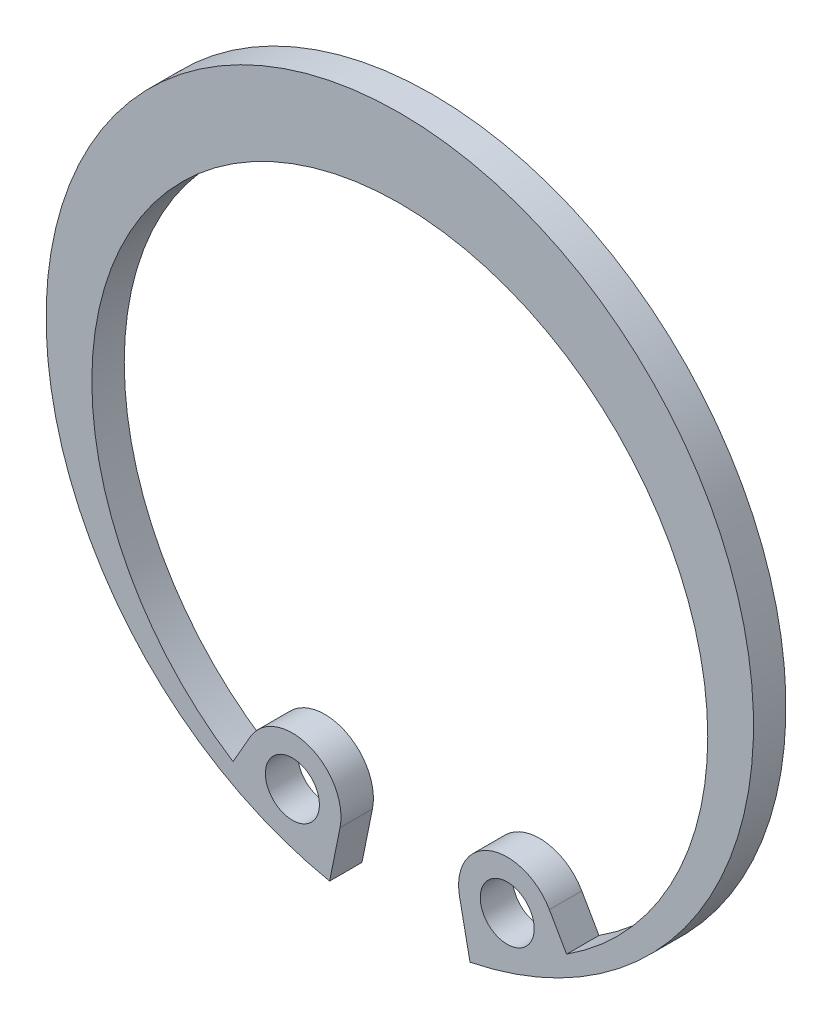
from build123d import *

# Parameters (mm, degrees)
SKETCH1_R          = 1
BASE_EXTRUDE_DEPTH = 1.2


with BuildPart() as part:
    # Sketch1 → Base-Extrude (new body)
    with BuildSketch(Plane.XY):
        with BuildLine():
            Line((-2.214111577, -10.933787538), (-2.6, -12.839392509))
            ThreePointArc((-2.6, -12.839392509), (0, 13.1), (2.6, -12.839392509))
            Line((2.6, -12.839392509), (2.214111577, -10.933787538))
            ThreePointArc((2.214111577, -10.933787538), (3.344590946, -8.891777742), (5.540603713, -9.682546695))
            Line((5.540603713, -9.682546695), (6.176561753, -10.793922593))
            ThreePointArc((6.176561753, -10.793922593), (0, 10.2), (-6.176561753, -10.793922593))
            Line((-6.176561753, -10.793922593), (-5.540603713, -9.682546695))
            ThreePointArc((-5.540603713, -9.682546695), (-3.344590946, -8.891777742), (-2.214111577, -10.933787538))
        make_face()
        with Locations((3.978302914, -10.576535629)):
            Circle(SKETCH1_R, mode=Mode.SUBTRACT)
        with Locations(Location((-3.978302914, -10.576535629, 0), (0, 0, 180))):
            Circle(SKETCH1_R, mode=Mode.SUBTRACT)
    extrude(amount=BASE_EXTRUDE_DEPTH)


solid = part.part
